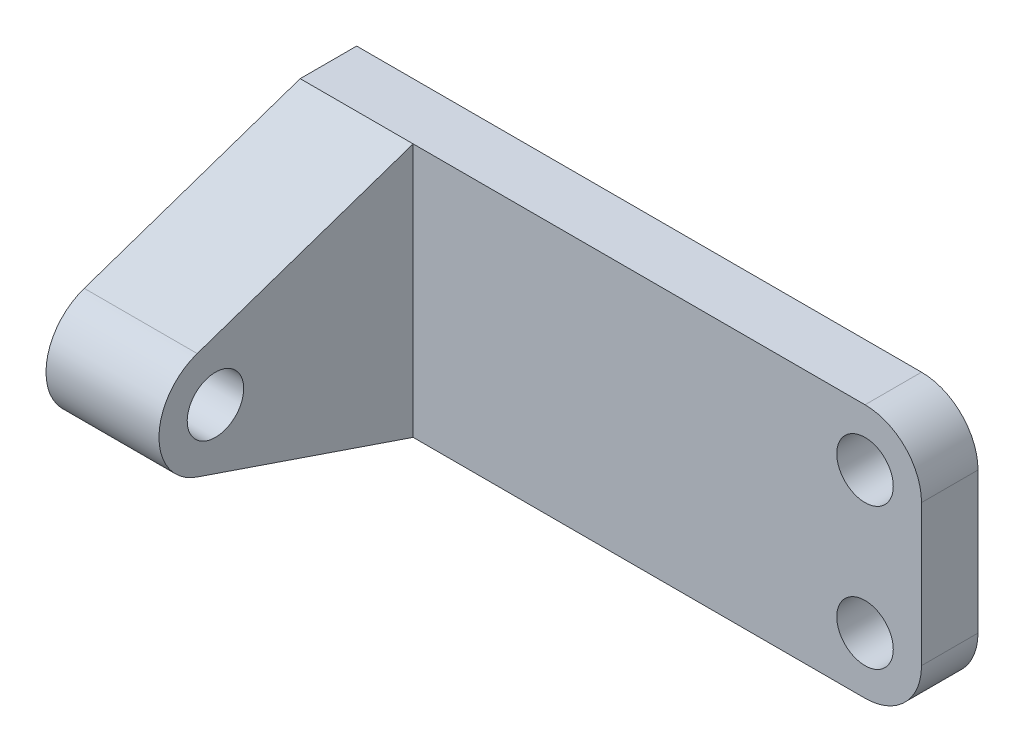
from build123d import *

# Parameters (mm, degrees)
SKETCH1_R           = 6.35
BOSS_EXTRUDE2_DEPTH = 12.7
SKETCH2_R           = 6.35
BOSS_EXTRUDE3_DEPTH = 25.4


with BuildPart() as part:
    # Sketch1 → Boss-Extrude2 (new body)
    with BuildSketch(Plane.XY):
        with BuildLine():
            Line((72.806693362, 70.739109347), (-54.193306638, 70.739109347))
            Line((-54.193306638, 70.739109347), (-54.193306638, 13.589109347))
            Line((-54.193306638, 13.589109347), (72.806693362, 13.589109347))
            ThreePointArc((72.806693362, 13.589109347), (81.786949483, 17.308853226), (85.506693362, 26.289109347))
            Line((85.506693362, 26.289109347), (85.506693362, 58.039109347))
            ThreePointArc((85.506693362, 58.039109347), (81.786949483, 67.019365468), (72.806693362, 70.739109347))
        make_face()
        with Locations((72.806693362, 58.039109347)):
            Circle(SKETCH1_R, mode=Mode.SUBTRACT)
        with Locations((72.806693362, 26.289109347)):
            Circle(SKETCH1_R, mode=Mode.SUBTRACT)
    extrude(amount=BOSS_EXTRUDE2_DEPTH)

    # Sketch2 → Boss-Extrude3 (add)
    with BuildSketch(Plane.ZY.offset(54.193306638)):
        with BuildLine():
            Line((12.7, 13.589109347), (61.248819539, 30.143723397))
            ThreePointArc((61.248819539, 30.143723397), (69.85, 42.164109347), (61.248819539, 54.184495297))
            Line((61.248819539, 54.184495297), (12.7, 70.739109347))
            Line((12.7, 70.739109347), (12.7, 13.589109347))
        make_face()
        with Locations(Location((57.15, 42.164109347, 0), (0, 0, 270))):
            Circle(SKETCH2_R, mode=Mode.SUBTRACT)
    extrude(amount=-BOSS_EXTRUDE3_DEPTH)


solid = part.part
